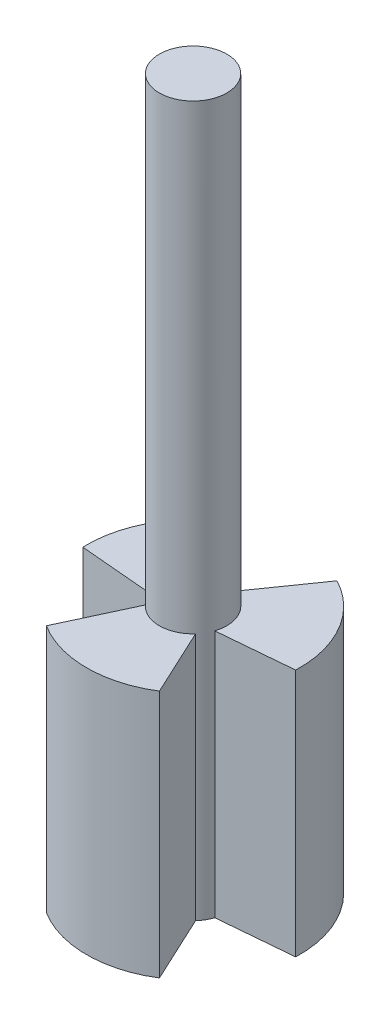
from build123d import *

# Parameters (mm, degrees)
SKETCH1_R           = 241.3
BOSS_EXTRUDE1_DEPTH = 5080
SKETCH2_R           = 762
BOSS_EXTRUDE3_DEPTH = 1778
CUT_EXTRUDE2_START  = -1778
CUT_EXTRUDE2_DEPTH  = 5252.397760119
CIRPATTERN1_COUNT   = 3
SCALE1_SCALE        = 0.02


with BuildPart() as part:
    # Sketch1 → Boss-Extrude1 (new body)
    with BuildSketch(Plane(origin=(0, 0, 0), x_dir=(1, 0, 0), z_dir=(0, 1, 0))):
        with Locations(Location((0, 0, 0), (0, 0, 90))):
            Circle(SKETCH1_R)
    extrude(amount=BOSS_EXTRUDE1_DEPTH)

    # Sketch2 → Boss-Extrude3 (add)
    with BuildSketch(Plane.XZ):
        with Locations(Location((0, 0, 0), (0, 0, 270))):
            Circle(SKETCH2_R)
    extrude(amount=-BOSS_EXTRUDE3_DEPTH)

    # Sketch4 → Cut-Extrude2 (cut)
    with BuildSketch(Plane(origin=(0, 1778, 0), x_dir=(1, 0, 0), z_dir=(0, 1, 0)).offset(CUT_EXTRUDE2_START)):
        with BuildLine():
            Line((2450.032308946, 3662.965924128), (356.689294384, 673.362270455))
            Line((356.689294384, 673.362270455), (50.425576786, 235.97235263))
            ThreePointArc((50.425576786, 235.97235263), (0, 241.3), (-50.425576786, 235.97235263))
            Line((-50.425576786, 235.97235263), (-356.689294384, 673.362270455))
            Line((-356.689294384, 673.362270455), (-2450.032308946, 3662.965924128))
            Line((-2450.032308946, 3662.965924128), (-2450.032308946, 10962.230265875))
            Line((-2450.032308946, 10962.230265875), (2450.032308946, 10962.230265875))
            Line((2450.032308946, 10962.230265875), (2450.032308946, 3662.965924128))
        make_face()
    cut_extrude2 = extrude(amount=CUT_EXTRUDE2_DEPTH, mode=Mode.SUBTRACT)

    # CirPattern1: Cut-Extrude2 ×3 about axis
    cirpattern1_axis = Axis((0, 5080, 0), (0, -1, 0))
    for i in range(1, CIRPATTERN1_COUNT):
        add(cut_extrude2.rotate(cirpattern1_axis, i * 360 / CIRPATTERN1_COUNT), mode=Mode.SUBTRACT)


with BuildPart() as part_1:
    # Scale1: scaled about (0, 1463.203660293, 0)
    add(part.part.scale(SCALE1_SCALE).moved(Location((0, 1433.939587087, 0))))


solid = part_1.part
